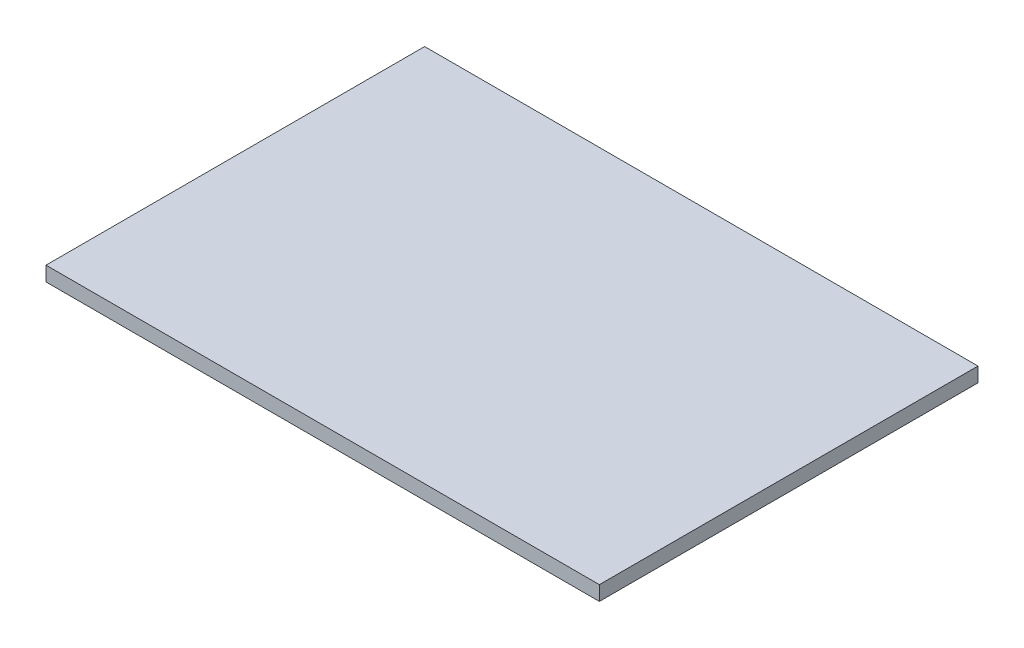
from build123d import *

# Parameters (mm, degrees)
SKETCH1_W           = 190
SKETCH1_H           = 130
BOSS_EXTRUDE1_DEPTH = 5


with BuildPart() as part:
    # Sketch1 → Boss-Extrude1 (new body)
    with BuildSketch(Plane(origin=(0, 0, 0), x_dir=(1, 0, 0), z_dir=(0, 1, 0))):
        Rectangle(SKETCH1_W, SKETCH1_H)
    extrude(amount=BOSS_EXTRUDE1_DEPTH)


solid = part.part
